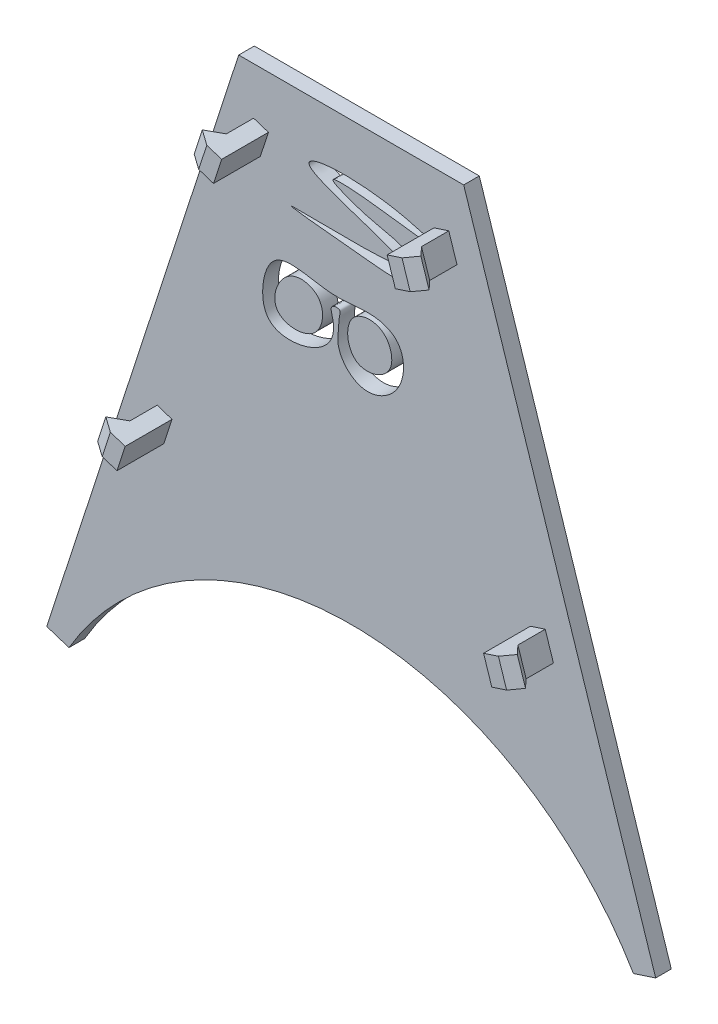
from build123d import *

# Parameters (mm, degrees)
EXTRUDE_1_DEPTH     = 2
EXTRUDE_2_DEPTH     = 6
EXTRUDE_3_DEPTH     = 43.399997
EXTRUDE_4_DEPTH     = 43.4
CUT_EXTRUDE_3_DEPTH = 43
SKETCH_9_W          = 6
SKETCH_9_H          = 36.6
CUT_EXTRUDE_4_DEPTH = 43
CUT_EXTRUDE_5_DEPTH = 43


with BuildPart() as part:
    # 草图1 → 凸台-拉伸1 (new body)
    with BuildSketch(Plane.XY):
        with BuildLine():
            Line((-39.030407411, 22.262670809), (-36.177258427, 21.335556536))
            ThreePointArc((-36.177258427, 21.335556536), (0, 42), (36.177258427, 21.335556536))
            Line((36.177258427, 21.335556536), (39.030407411, 22.262670809))
            Line((39.030407411, 22.262670809), (14.42, 98))
            Line((14.42, 98), (-14.42, 98))
            Line((-14.42, 98), (-39.030407411, 22.262670809))
        make_face()
    extrude(amount=EXTRUDE_1_DEPTH)

    # 草图2 → 凸台-拉伸2 (add)
    with BuildSketch(Plane.XY.offset(2)):
        Polygon((-12.509991115, 91.944063569), (-25.922244266, 50.668508268), (-24.020144943, 50.050432086), (-10.607891792, 91.325987387), align=None)
        Polygon((25.922244266, 50.668508268), (24.020144943, 50.050432086), (10.607891792, 91.325987387), (12.509991115, 91.944063569), align=None)
    extrude(amount=EXTRUDE_2_DEPTH)

    # 草图4 → 凸台-拉伸3 (add)
    with BuildSketch(Plane(origin=(25.82857133, 79.486169273, 0), x_dir=(0.9510496613169626, -0.3090380910323043, 0), z_dir=(0.3090380910323043, 0.9510496613169626, 0))):
        Polygon((-40.3118407, -5.487687012), (-41.891406331, -7.075947827), (-40.3118407, -8), align=None)
    extrude(amount=-EXTRUDE_3_DEPTH)

    # 草图5 → 凸台-拉伸4 (add)
    with BuildSketch(Plane(origin=(-25.82857133, 79.486169273, 0), x_dir=(0.9510496613169626, 0.3090380910323043, 0), z_dir=(-0.3090380910323043, 0.9510496613169626, 0))):
        Polygon((40.3118407, -8), (41.895939059, -7.08374), (40.3118407, -5.5), align=None)
    extrude(amount=-EXTRUDE_4_DEPTH)

    # 草图8 → 切除-拉伸3 (cut)
    with BuildSketch(Plane(origin=(-36.436463122, 11.839818114, 0), x_dir=(0, 0, -1), z_dir=(0.9510496613169628, -0.30903809103230395, 0))):
        Polygon((-2, 43.577306744), (-8, 43.577306744), (-8, 80.212597126), (-2.818513161, 80.212597126), (-2, 80.212597126), align=None)
    extrude(amount=-CUT_EXTRUDE_3_DEPTH, mode=Mode.SUBTRACT)

    # 草图9 → 切除-拉伸4 (cut)
    with BuildSketch(Plane(origin=(36.436463122, 11.839818114, 0), x_dir=(0, 0, 1), z_dir=(-0.9510496613169628, -0.30903809103230395, 0))):
        with Locations((5, 61.877306744)):
            Rectangle(SKETCH_9_W, SKETCH_9_H)
    extrude(amount=-CUT_EXTRUDE_4_DEPTH, mode=Mode.SUBTRACT)

    # 草图10 → 切除-拉伸5 (cut)
    # profile 1 of 2: a face of its own
    with BuildSketch(Plane(origin=(0, 0, 0), x_dir=(-1, 0, 0), z_dir=(0, 0, -1))):
        with BuildLine():
            add(Edge.make_bspline(
                [(-7.079929635, 90.5764263), (-0.416332173, 92.111966928), (14.05274088, 91.000202068), (-18.974255469, 83.410367588), (14.429269177, 85.199998512), (1.597956135, 83.835086368), (-2.230943097, 83.47419356), (-8.991278483, 82.821894761), (-8.454622583, 86.398057593), (-6.033091605, 87.518599532), (-3.09700708, 88.050437432), (-0.487467509, 88.77876824), (4.796294503, 90.858561457), (-4.73788989, 89.92698459), (-7.259297971, 89.430848947), (-12.535418526, 88.957822516), (-9.27269383, 90.071131895), (-7.079929635, 90.5764263)],
                knots=[0, 0, 0, 0, 0.143751369, 0.291636445, 0.456175681, 0.517604099, 0.580121576, 0.648203343, 0.661791931, 0.691326188, 0.732233185, 0.765974011, 0.798027973, 0.870615761, 0.927947813, 0.952696294, 1, 1, 1, 1], degree=3))
        make_face()
    # profile 2 of 2: a face of its own
    with BuildSketch(Plane(origin=(0, 0, 0), x_dir=(-1, 0, 0), z_dir=(0, 0, -1))):
        with BuildLine():
            add(Edge.make_bspline(
                [(9.819730457, 77.47312361), (10.728692646, 76.734691792), (11.630629218, 74.044306315), (10.824322829, 68.610277246), (3.007788581, 69.914805184), (1.951793555, 73.908550907), (2.870028272, 76.260775233), (1.191346859, 76.333080425), (1.64064624, 75.119118035), (1.556223041, 74.056404886), (2.052867726, 71.552305455), (-1.219251321, 67.601283217), (-7.070531234, 70.66072811), (-6.921766751, 76.266542921), (-2.496495426, 78.209710542), (2.464453906, 76.581875692), (8.140526043, 78.837292533), (9.819730457, 77.47312361)],
                knots=[0, 0, 0, 0, 0.073373994, 0.131989409, 0.267967904, 0.331163007, 0.354135494, 0.371122687, 0.384936775, 0.408065889, 0.43469413, 0.52023079, 0.617221489, 0.713003261, 0.749397367, 0.86444988, 1, 1, 1, 1], degree=3))
        make_face()
        with BuildLine():
            add(Edge.make_bspline(
                [(-0.208714588, 76.113864669), (-1.069789273, 77.115368873), (-4.675005618, 77.505458019), (-6.083075859, 71.907559422), (0.326185891, 70.026978872), (0.868271893, 74.861236402), (-0.208714588, 76.113864669)],
                knots=[0, 0, 0, 0, 0.2233896, 0.465364561, 0.720596153, 1, 1, 1, 1], degree=3))
        make_face(mode=Mode.SUBTRACT)
        with BuildLine():
            add(Edge.make_bspline(
                [(7.608282592, 76.870593945), (6.417597899, 77.412053608), (3.089669883, 76.653959868), (3.878855714, 70.753089794), (11.319270068, 71.029293158), (9.328178171, 76.088477499), (7.608282592, 76.870593945)],
                knots=[0, 0, 0, 0, 0.201332525, 0.441308556, 0.709183362, 1, 1, 1, 1], degree=3))
        make_face(mode=Mode.SUBTRACT)
    extrude(amount=-CUT_EXTRUDE_5_DEPTH, mode=Mode.SUBTRACT)


with BuildPart() as cut_extrude_5_piece_1:
    # of the separate pieces the step leaves, piece 1, a body of its own (cut_extrude_5_pieces)
    add(part.part.solids().sort_by_distance((-39.030407411, 22.262670809, 0))[0])


with BuildPart() as cut_extrude_5_piece_2:
    # of the separate pieces the step leaves, piece 2, a body of its own (cut_extrude_5_pieces)
    add(part.part.solids().sort_by_distance((-7.608282592, 76.870593945, 0))[0])


with BuildPart() as cut_extrude_5_piece_3:
    # of the separate pieces the step leaves, piece 3, a body of its own (cut_extrude_5_pieces)
    add(part.part.solids().sort_by_distance((0.208714588, 76.113864669, 0))[0])


solid = Compound([cut_extrude_5_piece_1.part, cut_extrude_5_piece_2.part, cut_extrude_5_piece_3.part])
